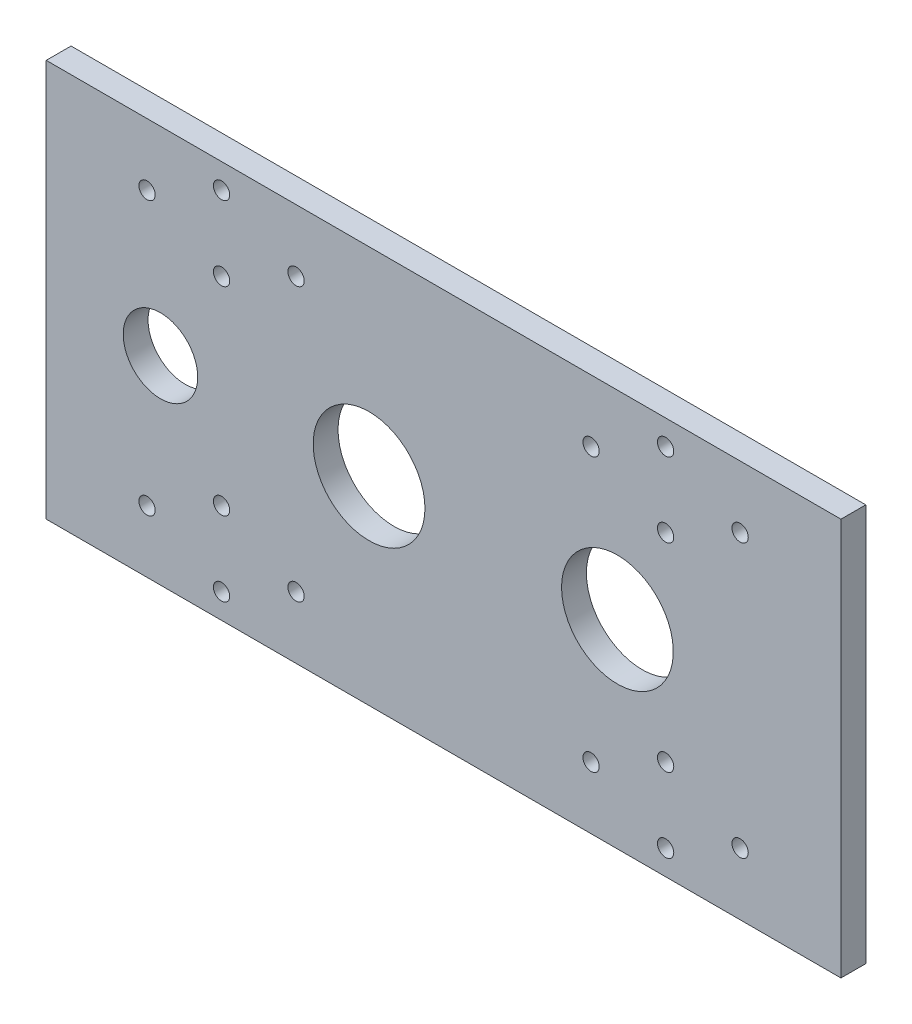
from build123d import *

# Parameters (mm, degrees)
SKETCH1_W               = 203.2
SKETCH1_H               = 101.6
BOSS_EXTRUDE1_DEPTH     = 6.35
SKETCH3_R               = 14.2875
SKETCH3_R_2             = 9.525
CUT_EXTRUDE2_DEPTH      = 6.35
SKETCH5_R               = 2.0828
CUT_EXTRUDE3_DEPTH      = 228.273233136
MIRROR2_COPY_1_SKETCH_R = 2.0828
MIRROR2_COPY_1_DEPTH    = 228.273233136


with BuildPart() as part:
    # Sketch1 → Boss-Extrude1 (new body)
    with BuildSketch(Plane.XY):
        with Locations((101.6, 50.8)):
            Rectangle(SKETCH1_W, SKETCH1_H)
    extrude(amount=BOSS_EXTRUDE1_DEPTH)

    # Sketch3 → Cut-Extrude2 (cut)
    with BuildSketch(Plane.XY.offset(6.35)):
        with Locations((82.55, 50.8)):
            Circle(SKETCH3_R)
        with Locations(Location((146.05, 50.8, 0), (0, 0, 180))):
            Circle(SKETCH3_R)
        with Locations((29.21, 50.8)):
            Circle(SKETCH3_R_2)
    extrude(amount=-CUT_EXTRUDE2_DEPTH, mode=Mode.SUBTRACT)

    # Sketch5 → Cut-Extrude3 (cut, through all)
    with BuildSketch(Plane.XY.offset(6.35)):
        with Locations((139.319, 85.725)):
            Circle(SKETCH5_R)
        with Locations((158.369, 95.25)):
            Circle(SKETCH5_R)
        with Locations((158.369, 76.2)):
            Circle(SKETCH5_R)
        with Locations((177.419, 85.725)):
            Circle(SKETCH5_R)
    cut_extrude3 = extrude(amount=-CUT_EXTRUDE3_DEPTH, mode=Mode.SUBTRACT)

    # Mirror1: Cut-Extrude3 across plane
    add(cut_extrude3.mirror(Plane.ZX.offset(50.8)), mode=Mode.SUBTRACT)

    # Mirror2: Cut-Extrude3 across plane
    add(cut_extrude3.mirror(Plane(origin=(101.6, 0, 0), x_dir=(0, 0, 1), z_dir=(1, 0, 0))), mode=Mode.SUBTRACT)

    # Mirror2 copy 1 sketch → Mirror2 copy 1 (cut, through all)
    with BuildSketch(Plane(origin=(203.2, 101.6, 6.35), x_dir=(-1, 0, 0), z_dir=(0, 0, 1))):
        with Locations((139.319, 85.725)):
            Circle(MIRROR2_COPY_1_SKETCH_R)
        with Locations((158.369, 95.25)):
            Circle(MIRROR2_COPY_1_SKETCH_R)
        with Locations((158.369, 76.2)):
            Circle(MIRROR2_COPY_1_SKETCH_R)
        with Locations((177.419, 85.725)):
            Circle(MIRROR2_COPY_1_SKETCH_R)
    extrude(amount=-MIRROR2_COPY_1_DEPTH, mode=Mode.SUBTRACT)


solid = part.part
